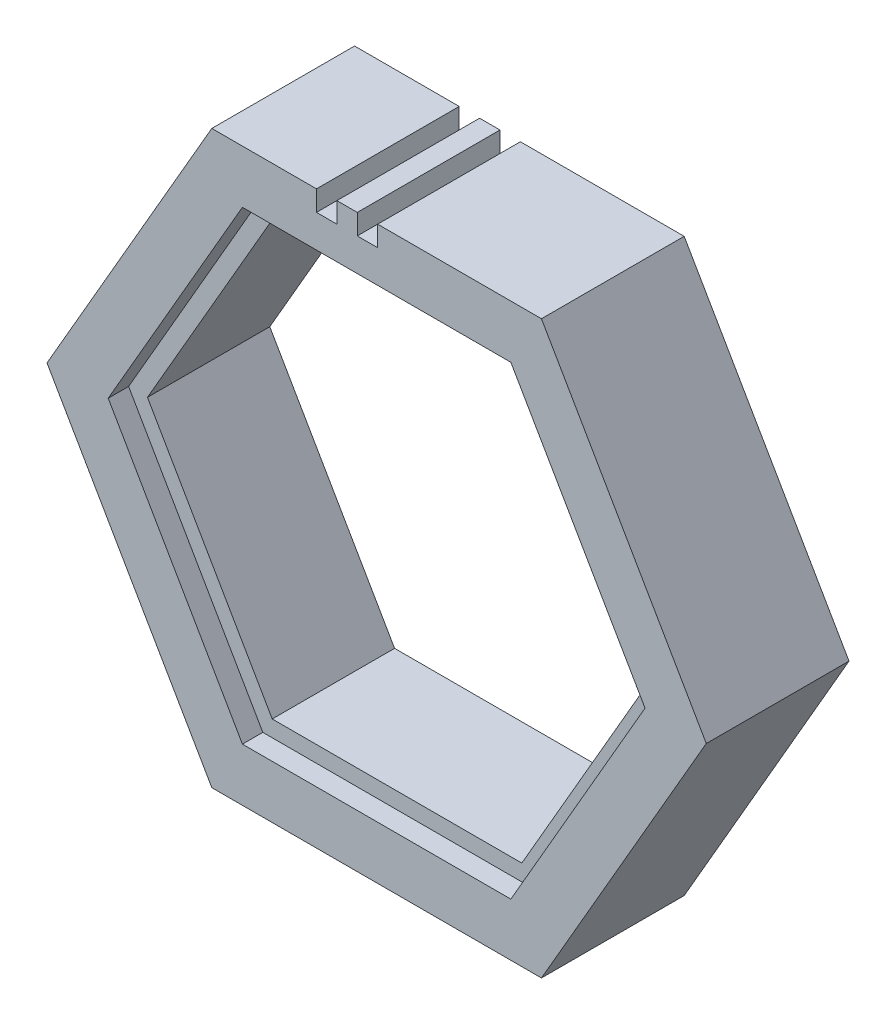
from build123d import *

# Parameters (mm, degrees)
BOSS_EXTRUDE1_DEPTH      = 1
BOSS_EXTRUDE1_DEPTH_BACK = 2.5
BOSS_EXTRUDE2_DEPTH      = 0.5
BOSS_EXTRUDE2_DEPTH_BACK = 2.5
SKETCH4_W                = 0.5
SKETCH4_H                = 0.5
CUT_EXTRUDE1_DEPTH       = 12.250925888


with BuildPart() as part:
    # Sketch1 → Boss-Extrude1 (new, two sides: drawn at the far end of the back side and taken through both)
    with BuildSketch(Plane.XY.offset(-BOSS_EXTRUDE1_DEPTH_BACK)):
        Polygon((8.082903769, 0), (4.041451884, 7), (-4.041451884, 7), (-8.082903769, 0), (-4.041451884, -7), (4.041451884, -7), align=None)
        Polygon((6.581793069, 0), (3.290896534, 5.7), (-3.290896534, 5.7), (-6.581793069, 0), (-3.290896534, -5.7), (3.290896534, -5.7), align=None, mode=Mode.SUBTRACT)
    extrude(amount=BOSS_EXTRUDE1_DEPTH + BOSS_EXTRUDE1_DEPTH_BACK)

    # Sketch3 → Boss-Extrude2 (add, two sides: drawn at the far end of the back side and taken through both)
    with BuildSketch(Plane.XY.offset(-BOSS_EXTRUDE2_DEPTH_BACK)):
        Polygon((6.581793069, 0), (3.290896534, 5.7), (-3.290896534, 5.7), (-6.581793069, 0), (-3.290896534, -5.7), (3.290896534, -5.7), align=None)
        Polygon((6.119912853, 0), (3.059956427, 5.3), (-3.059956427, 5.3), (-6.119912853, 0), (-3.059956427, -5.3), (3.059956427, -5.3), align=None, mode=Mode.SUBTRACT)
    extrude(amount=BOSS_EXTRUDE2_DEPTH + BOSS_EXTRUDE2_DEPTH_BACK)

    # Sketch4 → Cut-Extrude1 (cut, through all)
    with BuildSketch(Plane.XY.offset(1)):
        with Locations((-1.224779595, 6.75)):
            Rectangle(SKETCH4_W, SKETCH4_H)
        with Locations((-0.224779595, 6.75)):
            Rectangle(SKETCH4_W, SKETCH4_H)
    extrude(amount=-CUT_EXTRUDE1_DEPTH, mode=Mode.SUBTRACT)


solid = part.part
